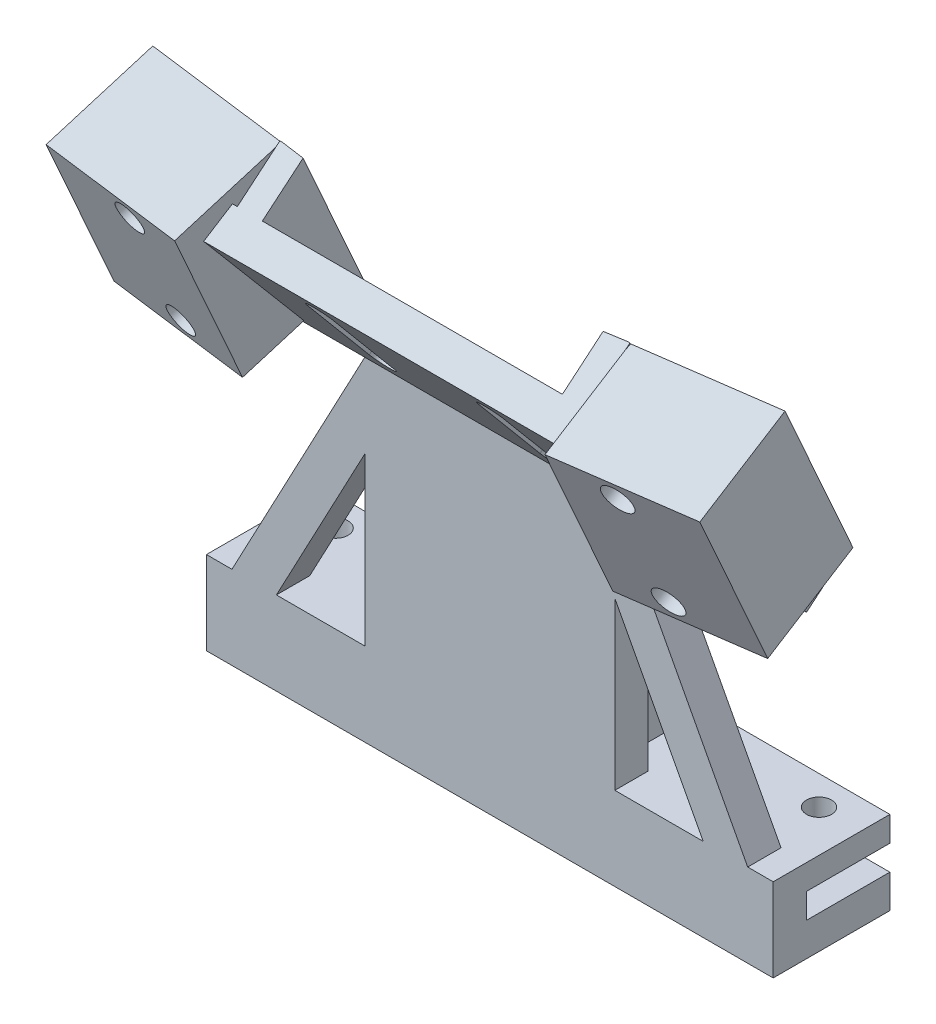
from build123d import *

# Parameters (mm, degrees)
EXTRUDE_1_DEPTH       = 68
SKETCH_2_R            = 1.5
CUT_EXTRUDE_1_DEPTH   = 60
SKETCH_3_W            = 30
SKETCH_3_H            = 4
EXTRUDE_2_DEPTH       = 40
EXTRUDE_3_DEPTH       = 30
CUT_EXTRUDE_2_DEPTH   = 4
EXTRUDE_4_DEPTH       = 23
EXTRUDE_START         = -53
EXTRUDE_5_DEPTH       = 23
EXTRUDE_6_DEPTH       = 3
EXTRUDE_7_DEPTH       = 0.66666
SKETCH_17_W           = 17.087989765
SKETCH_17_H           = 19.996406133
EXTRUDE_9_DEPTH       = 12
SKETCH_19_R           = 1.8
CUT_EXTRUDE_3_DEPTH   = 20
SKETCH_20_W           = 61.603006609
SKETCH_20_H           = 84.586869481
CUT_EXTRUDE_4_DEPTH   = 65
SKETCH_21_W           = 7.494214953
SKETCH_21_H           = 26.873102225
CUT_EXTRUDE_5_DEPTH   = 2
SKETCH_22_W           = 9.970658679
SKETCH_22_H           = 25.794738871
CUT_EXTRUDE_6_DEPTH   = 2
EXTRUDE_10_DEPTH      = 4
EXTRUDE_11_DEPTH      = 12
EXTRUDE_11_DEPTH_BACK = 12


with BuildPart() as part:
    # 草图1 → 凸台-拉伸1 (new body)
    with BuildSketch(Plane(origin=(0, 0, 0), x_dir=(0, 0, -1), z_dir=(1, 0, 0))):
        Polygon((0, 0), (0, 4), (-10, 4), (-10, 7), (0, 7), (0, 10), (-14, 10), (-14, 0), align=None)
    extrude(amount=EXTRUDE_1_DEPTH)

    # 草图2 → 切除-拉伸1 (cut)
    with BuildSketch(Plane(origin=(0, 10, 0), x_dir=(1, 0, 0), z_dir=(0, 1, 0))):
        with Locations(Location((5, -3.5, 0), (0, 0, 270))):
            Circle(SKETCH_2_R)
        with Locations(Location((63, -3.5, 0), (0, 0, 270))):
            Circle(SKETCH_2_R)
    extrude(amount=-CUT_EXTRUDE_1_DEPTH, mode=Mode.SUBTRACT)

    # 草图3 → 凸台-拉伸2 (add)
    with BuildSketch(Plane.XZ):
        with Locations((34, 12)):
            Rectangle(SKETCH_3_W, SKETCH_3_H)
    extrude(amount=-EXTRUDE_2_DEPTH)

    # 草图4 → 凸台-拉伸3 (add)
    with BuildSketch(Plane(origin=(49, 0, 0), x_dir=(0, 0, -1), z_dir=(1, 0, 0))):
        Polygon((-14, 40), (-26.357684131, 54.727314459), (-23.293506358, 57.298464898), (-10, 41.455880937), (-10, 40), align=None)
    extrude(amount=-EXTRUDE_3_DEPTH)

    # 草图5 → 切除-拉伸2 (cut)
    with BuildSketch(Plane(origin=(0, 9.633382176, -11.480617817), x_dir=(1, 0, 0), z_dir=(0, -0.6427876096865429, 0.7660444431189751))):
        with BuildLine():
            Line((25.25, 55.318123989), (25.25, 43.864814933))
            ThreePointArc((25.25, 43.864814933), (23.75, 42.364814933), (22.25, 43.864814933))
            Line((22.25, 43.864814933), (22.25, 55.318123989))
            ThreePointArc((22.25, 55.318123989), (23.75, 56.818123989), (25.25, 55.318123989))
        make_face()
        with BuildLine():
            Line((42.75, 55.318123989), (42.75, 43.864814933))
            ThreePointArc((42.75, 43.864814933), (44.25, 42.364814933), (45.75, 43.864814933))
            Line((45.75, 43.864814933), (45.75, 55.318123989))
            ThreePointArc((45.75, 55.318123989), (44.25, 56.818123989), (42.75, 55.318123989))
        make_face()
    extrude(amount=-CUT_EXTRUDE_2_DEPTH, mode=Mode.SUBTRACT)

    # 草图6 → 凸台-拉伸4 (add)
    with BuildSketch(Plane.ZY.offset(-19)):
        Polygon((23.293506358, 57.298464898), (26.357684131, 54.727314459), (14, 40), (10.935822228, 42.571150439), align=None)
    extrude(amount=EXTRUDE_4_DEPTH)

    # 草图7 → 凸台-拉伸5 (add)
    with BuildSketch(Plane.ZY.offset(4).offset(EXTRUDE_START)):
        Polygon((23.293506358, 57.298464898), (26.357684131, 54.727314459), (14, 40), (10.935822228, 42.571150439), align=None)
    extrude(amount=-EXTRUDE_5_DEPTH)

    # 草图10 → 凸台-拉伸6 (add)
    with BuildSketch(Plane(origin=(52, 0, 0), x_dir=(0, 0.7660444431189749, 0.6427876096865431), z_dir=(-1, 0, 0))):
        Polygon((39.64080426, 18.986882184), (58.865947907, 18.986882184), (58.865947907, 25.653542184), (39.64080426, 20.653542184), align=None)
    extrude(amount=-EXTRUDE_6_DEPTH)

    # 草图15 → 凸台-拉伸7 (add)
    with BuildSketch(Plane(origin=(-0.224740323, 0.898508111, -2.01476807), x_dir=(0.9948507831271028, 0.04127952147527669, -0.09256306184522162), z_dir=(0.10135047760810084, -0.4051975406133526, 0.9085939873064868))):
        Polygon((55.510576319, 63.468125115), (55.510576319, 62.353864223), (55.510576319, 43.471718982), (72.598566084, 43.471718982), (72.598566084, 62.353864223), (72.598566084, 63.468125115), align=None)
    extrude(amount=-EXTRUDE_7_DEPTH)

    # 草图17 → 凸台-拉伸9 (add)
    with BuildSketch(Plane(origin=(-0.224740323, 0.898508111, -2.01476807), x_dir=(0.994850783127103, 0.04127952147527699, -0.09256306184522194), z_dir=(0.10135047760810126, -0.40519754061335256, 0.9085939873064869))):
        with Locations((64.054571201, 53.469922049)):
            Rectangle(SKETCH_17_W, SKETCH_17_H)
    extrude(amount=EXTRUDE_9_DEPTH)

    # 草图19 → 切除-拉伸3 (cut)
    with BuildSketch(Plane(origin=(-0.292306632, 1.168637103, -2.620491338), x_dir=(-0.9948507831271028, -0.04127952147527692, 0.09256306184522202), z_dir=(-0.10135047760810131, 0.40519754061335245, -0.908593987306487))):
        with Locations(Location((-62.598566084, 60.969922048, 0), (0, 0, 90))):
            Circle(SKETCH_19_R)
        with Locations(Location((-62.598566084, 45.969922048, 0), (0, 0, 270))):
            Circle(SKETCH_19_R)
    extrude(amount=-CUT_EXTRUDE_3_DEPTH, mode=Mode.SUBTRACT)

    # 草图20 → 切除-拉伸4 (cut)
    with BuildSketch(Plane.ZY.offset(-34)):
        with Locations((16.944749698, 32.191708304)):
            Rectangle(SKETCH_20_W, SKETCH_20_H)
    extrude(amount=CUT_EXTRUDE_4_DEPTH, mode=Mode.SUBTRACT)

    # 镜向7: part across plane


with BuildPart() as part_1:
    add(part.part)
    add(part.part.mirror(Plane.ZY.offset(-34)))

    # 草图21 → 切除-拉伸5 (cut)
    with BuildSketch(Plane(origin=(-0.292306632, 1.168637103, -2.620491338), x_dir=(-0.9948507831271028, -0.04127952147527692, 0.09256306184522202), z_dir=(-0.10135047760810131, 0.40519754061335245, -0.908593987306487))):
        with Locations((-54.514442647, 53.802326892)):
            Rectangle(SKETCH_21_W, SKETCH_21_H)
    extrude(amount=CUT_EXTRUDE_5_DEPTH, mode=Mode.SUBTRACT)

    # 草图22 → 切除-拉伸6 (cut)
    with BuildSketch(Plane(origin=(0.990797146, 3.961190673, -8.882368888), x_dir=(-0.9948507831271028, 0.04127952147527693, -0.09256306184522203), z_dir=(0.10135047760810131, 0.40519754061335256, -0.9085939873064868))):
        with Locations((-12.026553315, 54.032339334)):
            Rectangle(SKETCH_22_W, SKETCH_22_H)
    extrude(amount=CUT_EXTRUDE_6_DEPTH, mode=Mode.SUBTRACT)

    # 草图24 → 凸台-拉伸10 (add)
    with BuildSketch(Plane.XY.offset(14)):
        Polygon((19, 40), (3.059166743, 10), (8.395226669, 10), (19, 29.957752195), align=None)
        Polygon((49, 40), (64.940833257, 10), (59.604773331, 10), (49, 29.957752195), align=None)
    extrude(amount=-EXTRUDE_10_DEPTH)

    # 草图29 → 凸台-拉伸11 (add, two sides: drawn at the far end of the back side and taken through both)
    with BuildSketch(Plane.ZY.offset(-34).offset(-EXTRUDE_11_DEPTH_BACK)):
        Polygon((10, 10), (2.792361366, 10), (10, 41.455880937), align=None)
    extrude(amount=EXTRUDE_11_DEPTH + EXTRUDE_11_DEPTH_BACK)


solid = part_1.part
